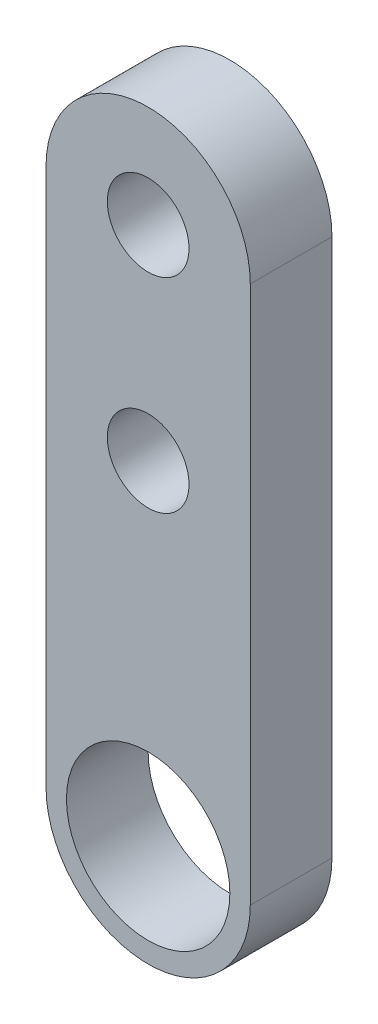
from build123d import *

# Parameters (mm, degrees)
SKETCH_1_R      = 1
SKETCH_1_R_2    = 2
EXTRUDE_1_DEPTH = 2


with BuildPart() as part:
    # 스케치1 → 보스-돌출1 (new body)
    with BuildSketch(Plane.XY):
        with BuildLine():
            Line((-2.5, 9.085), (-2.5, -4.085))
            ThreePointArc((-2.5, -4.085), (0, -6.585), (2.5, -4.085))
            Line((2.5, -4.085), (2.5, 9.085))
            ThreePointArc((2.5, 9.085), (0, 11.585), (-2.5, 9.085))
        make_face()
        with Locations((0, 4.085)):
            Circle(SKETCH_1_R, mode=Mode.SUBTRACT)
        with Locations((0, -4.085)):
            Circle(SKETCH_1_R_2, mode=Mode.SUBTRACT)
        with Locations((0, 9.085)):
            Circle(SKETCH_1_R, mode=Mode.SUBTRACT)
    extrude(amount=EXTRUDE_1_DEPTH)


solid = part.part
